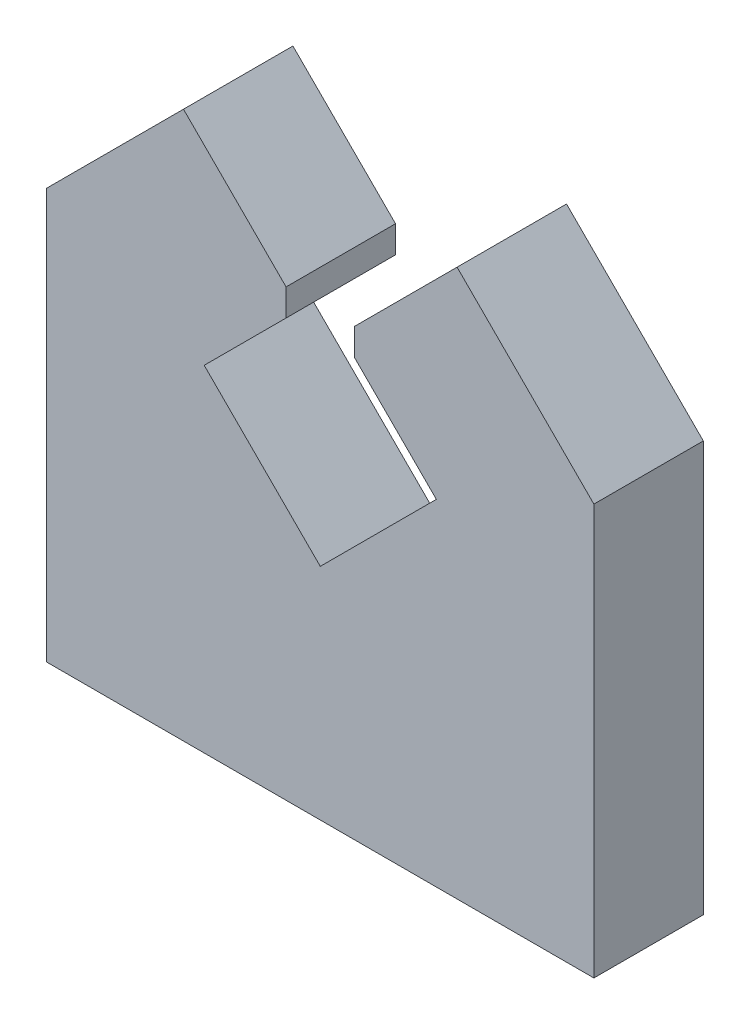
from build123d import *

# Parameters (mm, degrees)
BOSS_EXTRUDE1_DEPTH = 80


with BuildPart() as part:
    # Sketch1 → Boss-Extrude1 (new body)
    with BuildSketch(Plane.XY):
        Polygon((0, 300), (100, 400), (175, 325), (175, 305.294372515), (115.147186258, 245.441558773), (200, 160.58874503), (284.852813742, 245.441558773), (225, 305.294372515), (225, 325), (300, 400), (400, 300), (400, 0), (0, 0), align=None)
    extrude(amount=BOSS_EXTRUDE1_DEPTH)


solid = part.part
